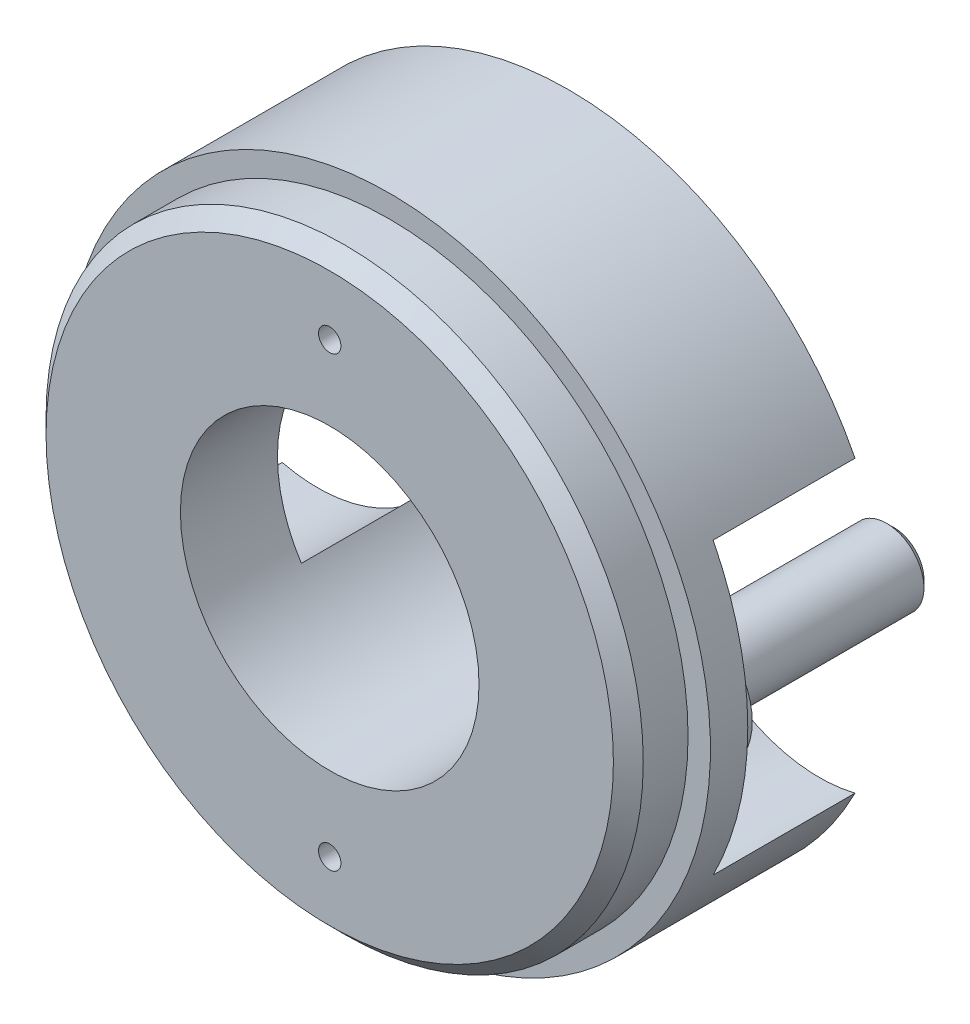
from build123d import *

# Parameters (mm, degrees)
CHAMFER1_SIZE                = 1
SKETCH3_R                    = 4.5
BOSS_EXTRUDE2_DEPTH          = 0.5
SKETCH4_R                    = 2.5
BOSS_EXTRUDE3_DEPTH          = 14
CHAMFER2_SIZE                = 0.5
CIRPATTERN1_COUNT            = 2
CHAMFER2_OF_CIRPATTERN1_SIZE = 0.5
BOSS_EXTRUDE4_DEPTH          = 9.5
SKETCH6_R                    = 0.75
CUT_EXTRUDE2_DEPTH           = 2
SKETCH6_3_R                  = 0.75
CUT_EXTRUDE3_DEPTH           = 35.358405085
CHAMFER3_SIZE                = 0.5
CIRPATTERN2_COUNT            = 2
CHAMFER3_OF_CIRPATTERN2_SIZE = 0.5


with BuildPart() as part:
    # Sketch1 → Revolve1 (revolve)
    with BuildSketch(Plane(origin=(0, 0, 0), x_dir=(0, 0, -1), z_dir=(1, 0, 0)), mode=Mode.PRIVATE) as revolve1_sk:
        Polygon((0, 20), (0, 10), (6.5, 10), (6.5, 13.235638921), (6.5, 20.468347011), (6.5, 21.5), (4, 21.5), (4, 20), align=None)
    revolve(revolve1_sk.sketch.rotate(Axis((0, 0, 0), (0, 0, 1)), 90), axis=Axis((0, 0, 0), (0, 0, 1)))

    # Chamfer1
    chamfer1_edges = [part.edges().sort_by_distance(p)[0] for p in [
        (20, 0, 0),
    ]]
    chamfer(chamfer1_edges, length=CHAMFER1_SIZE)

    # Sketch3 → Boss-Extrude2 (add)
    with BuildSketch(Plane(origin=(0, 0, -6.5), x_dir=(-1, 0, 0), z_dir=(0, 0, -1))):
        with Locations((16.8, 0)):
            Circle(SKETCH3_R)
    boss_extrude2 = extrude(amount=BOSS_EXTRUDE2_DEPTH)

    # Sketch4 → Boss-Extrude3 (add)
    with BuildSketch(Plane(origin=(0, 0, -7), x_dir=(-1, 0, 0), z_dir=(0, 0, -1))):
        with Locations((16.8, 0)):
            Circle(SKETCH4_R)
    boss_extrude3 = extrude(amount=BOSS_EXTRUDE3_DEPTH)

    # Chamfer2
    chamfer2_edges = [part.edges().sort_by_distance(p)[0] for p in [
        (-14.3, 0, -21),
    ]]
    chamfer(chamfer2_edges, length=CHAMFER2_SIZE)

    # CirPattern1: Boss-Extrude2, Boss-Extrude3 ×2 about axis
    cirpattern1_axis = Axis((0, 0, 0), (0, 0, 1))
    add([boss_extrude2.rotate(cirpattern1_axis, i * 360 / CIRPATTERN1_COUNT) for i in range(1, CIRPATTERN1_COUNT)])
    add([boss_extrude3.rotate(cirpattern1_axis, i * 360 / CIRPATTERN1_COUNT) for i in range(1, CIRPATTERN1_COUNT)])

    # Chamfer2 of CirPattern1
    chamfer2_of_cirpattern1_edges = [part.edges().sort_by_distance(p)[0] for p in [
        (14.3, 0, -21),
    ]]
    chamfer(chamfer2_of_cirpattern1_edges, length=CHAMFER2_OF_CIRPATTERN1_SIZE)

    # Sketch5 → Boss-Extrude4 (add)
    with BuildSketch(Plane(origin=(0, 0, -6.5), x_dir=(-1, 0, 0), z_dir=(0, 0, -1))):
        with BuildLine():
            ThreePointArc((-8.4, -5.425863987), (-13.105433977, -9.292479858), (-19.18125, -9.712345156))
            ThreePointArc((-19.18125, -9.712345156), (0, -21.5), (19.18125, -9.712345156))
            ThreePointArc((19.18125, -9.712345156), (13.105433977, -9.292479858), (8.4, -5.425863987))
            ThreePointArc((8.4, -5.425863987), (0, -10), (-8.4, -5.425863987))
        make_face()
    boss_extrude4 = extrude(amount=BOSS_EXTRUDE4_DEPTH)

    # Sketch6 → Cut-Extrude2 (cut)
    # profile 1 of 2: a face of its own
    with BuildSketch(Plane(origin=(0, 0, -16), x_dir=(-1, 0, 0), z_dir=(0, 0, -1))):
        with BuildLine():
            ThreePointArc((3.105828541, -11.591109915), (0, -12), (-3.105828541, -11.591109915))
            Line((-3.105828541, -11.591109915), (-4.658742812, -17.386664873))
            ThreePointArc((-4.658742812, -17.386664873), (0, -18), (4.658742812, -17.386664873))
            Line((4.658742812, -17.386664873), (3.105828541, -11.591109915))
        make_face()
        with Locations((0, -15)):
            Circle(SKETCH6_R, mode=Mode.SUBTRACT)
    # profile 2 of 2: a face of its own
    with BuildSketch(Plane(origin=(0, 0, -16), x_dir=(-1, 0, 0), z_dir=(0, 0, -1))):
        with Locations((0, -15)):
            Circle(SKETCH6_R)
    cut_extrude2 = extrude(amount=-CUT_EXTRUDE2_DEPTH, mode=Mode.SUBTRACT)

    # Sketch6<3> → Cut-Extrude3 (cut, through all)
    with BuildSketch(Plane(origin=(0, 0, -16), x_dir=(-1, 0, 0), z_dir=(0, 0, -1))):
        with Locations((0, -15)):
            Circle(SKETCH6_3_R)
    cut_extrude3 = extrude(amount=-CUT_EXTRUDE3_DEPTH, mode=Mode.SUBTRACT)

    # Chamfer3
    chamfer3_edges = [part.edges().sort_by_distance(p)[0] for p in [
        (0, -12, -16),
        (-3.882285677, -14.488887394, -14),
        (3.882285677, -14.488887394, -16),
        (0, -18, -16),
    ]]
    chamfer(chamfer3_edges, length=CHAMFER3_SIZE)

    # CirPattern2: Boss-Extrude4, Cut-Extrude2, Cut-Extrude3 ×2 about axis
    cirpattern2_axis = Axis((0, 0, 0), (0, 0, 1))
    add([boss_extrude4.rotate(cirpattern2_axis, i * 360 / CIRPATTERN2_COUNT) for i in range(1, CIRPATTERN2_COUNT)])
    add([cut_extrude2.rotate(cirpattern2_axis, i * 360 / CIRPATTERN2_COUNT) for i in range(1, CIRPATTERN2_COUNT)], mode=Mode.SUBTRACT)
    add([cut_extrude3.rotate(cirpattern2_axis, i * 360 / CIRPATTERN2_COUNT) for i in range(1, CIRPATTERN2_COUNT)], mode=Mode.SUBTRACT)

    # Chamfer3 of CirPattern2
    chamfer3_of_cirpattern2_edges = [part.edges().sort_by_distance(p)[0] for p in [
        (0, 12, -16),
        (3.882285677, 14.488887394, -14),
        (-3.882285677, 14.488887394, -16),
        (0, 18, -16),
    ]]
    chamfer(chamfer3_of_cirpattern2_edges, length=CHAMFER3_OF_CIRPATTERN2_SIZE)


solid = part.part
